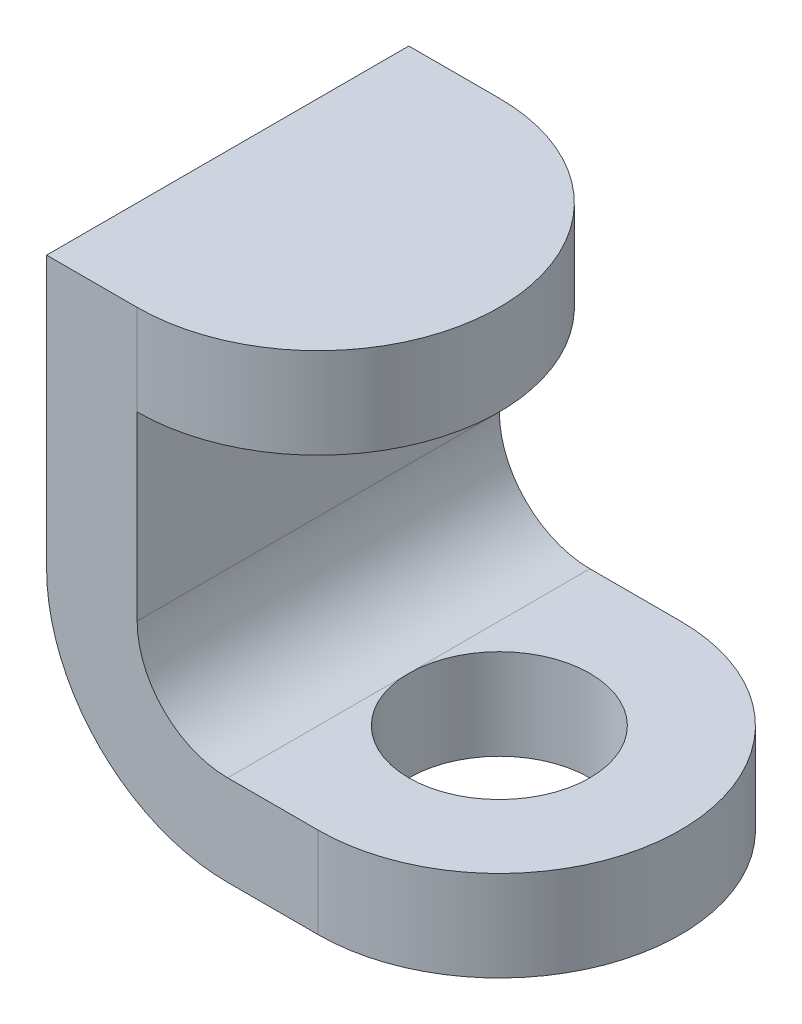
from build123d import *

# Parameters (mm, degrees)
EXTRUDE_THIN1_DEPTH = 20
FILLET1_R           = 20
FILLET2_R           = 10
FILLET3_RADIUS      = 20
FILLET3_LENGTH      = 10
FILLET4_RADIUS      = 20
FILLET4_LENGTH      = 10
SKETCH2_R           = 10
CUT_EXTRUDE1_DEPTH  = 68.082039325


with BuildPart() as part:
    # Sketch1 → Extrude-Thin1 (new, symmetric)
    with BuildSketch(Plane.XY):
        Polygon((50, 0), (0, 0), (0, 50), (30, 50), (30, 40), (10, 40), (10, 10), (50, 10), align=None)
    extrude(amount=EXTRUDE_THIN1_DEPTH, both=True)

    # Fillet1
    fillet1_edges = [part.edges().sort_by_distance(p)[0] for p in [
        (0, 0, 0),
    ]]
    fillet(fillet1_edges, radius=FILLET1_R)

    # Fillet2
    fillet2_edges = [part.edges().sort_by_distance(p)[0] for p in [
        (10, 10, 0),
    ]]
    fillet(fillet2_edges, radius=FILLET2_R)

    # Fillet3: full round fillet: the end face becomes a half cylinder, R = half its width
    fillet3_face = Plane((30, 45, 0), x_dir=(0, -1, 0), z_dir=(1, 0, 0))  # on the end face: x along it, z out of the body
    fillet3_slab = fillet3_face.offset(-FILLET3_RADIUS / 2) * Box(FILLET3_LENGTH, 2 * FILLET3_RADIUS, FILLET3_RADIUS, mode=Mode.PRIVATE)  # the body's end, R deep
    fillet3_round = Plane((10, 45, 0), x_dir=(1, 0, 0), z_dir=(0, -1, 0)) * Cylinder(FILLET3_RADIUS, FILLET3_LENGTH, mode=Mode.PRIVATE)  # its axis R under the face
    add(fillet3_slab - fillet3_round, mode=Mode.SUBTRACT)

    # Fillet4: full round fillet: the end face becomes a half cylinder, R = half its width
    fillet4_face = Plane((50, 5, 0), x_dir=(0, -1, 0), z_dir=(1, 0, 0))  # on the end face: x along it, z out of the body
    fillet4_slab = fillet4_face.offset(-FILLET4_RADIUS / 2) * Box(FILLET4_LENGTH, 2 * FILLET4_RADIUS, FILLET4_RADIUS, mode=Mode.PRIVATE)  # the body's end, R deep
    fillet4_round = Plane((30, 5, 0), x_dir=(1, 0, 0), z_dir=(0, -1, 0)) * Cylinder(FILLET4_RADIUS, FILLET4_LENGTH, mode=Mode.PRIVATE)  # its axis R under the face
    add(fillet4_slab - fillet4_round, mode=Mode.SUBTRACT)

    # Sketch2 → Cut-Extrude1 (cut, through all)
    with BuildSketch(Plane(origin=(0, 10, 0), x_dir=(1, 0, 0), z_dir=(0, 1, 0))):
        with Locations(Location((30, 0, 0), (0, 0, 180))):
            Circle(SKETCH2_R)
    extrude(amount=-CUT_EXTRUDE1_DEPTH, mode=Mode.SUBTRACT)


solid = part.part
